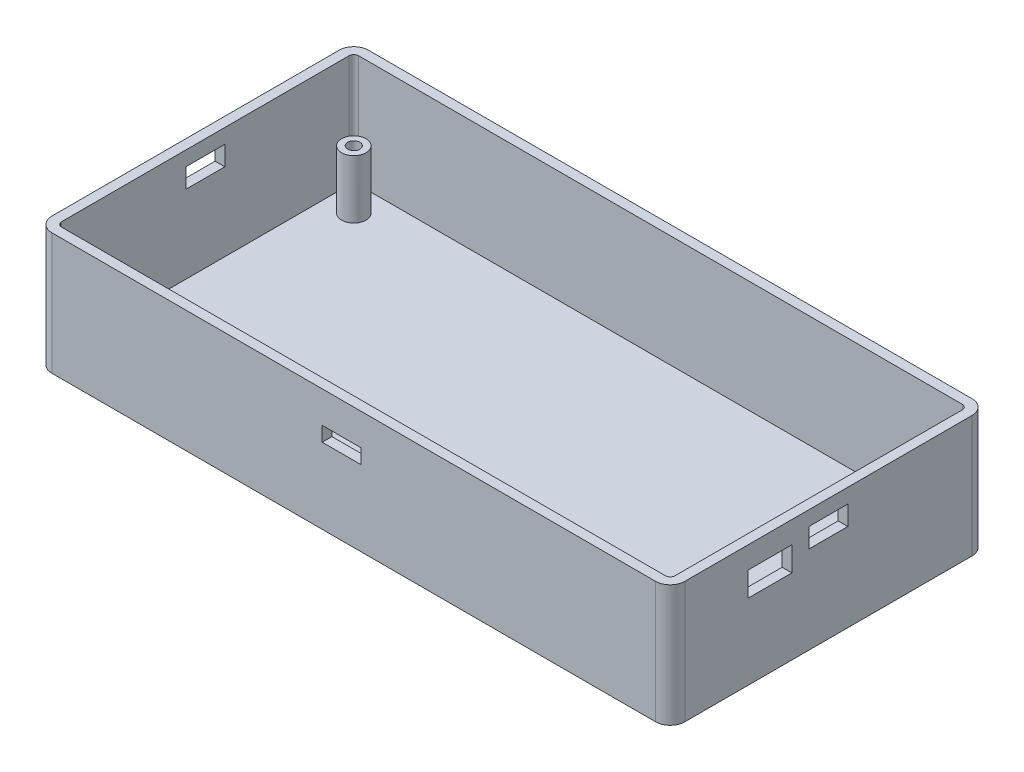
from build123d import *

# Parameters (mm, degrees)
SKETCH_1_W               = 130
SKETCH_1_H               = 65
EXTRUDE_1_DEPTH          = 25
SKETCH_2_W               = 126
SKETCH_2_H               = 61
CUT_EXTRUDE_1_DEPTH      = 23
SKETCH_3_R               = 2.5
EXTRUDE_2_DEPTH          = 12
SKETCH_5_W               = 8
SKETCH_5_H               = 4
CUT_EXTRUDE_3_DEPTH      = 2
SKETCH_6_W               = 8
SKETCH_6_H               = 3
CUT_EXTRUDE_4_DEPTH      = 2
SKETCH_7_W               = 9
SKETCH_7_H               = 5
CUT_EXTRUDE_5_DEPTH      = 2
SKETCH_8_R               = 1.25
CUT_EXTRUDE_6_DEPTH      = 6
MIRROR_7_COPY_1_SKETCH_R = 2.5
MIRROR_7_COPY_1_DEPTH    = 12
MIRROR_7_COPY_2_SKETCH_R = 1.25
MIRROR_7_COPY_2_DEPTH    = 6
FILLET_1_R               = 1
FILLET_2_R               = 3


with BuildPart() as part:
    # Эскиз1 → Бобышка-Вытянуть1 (new body)
    with BuildSketch(Plane(origin=(0, 0, 0), x_dir=(1, 0, 0), z_dir=(0, 1, 0))):
        Rectangle(SKETCH_1_W, SKETCH_1_H)
    extrude(amount=EXTRUDE_1_DEPTH)

    # Эскиз2 → Вырез-Вытянуть1 (cut)
    with BuildSketch(Plane(origin=(0, 25, 0), x_dir=(1, 0, 0), z_dir=(0, 1, 0))):
        Rectangle(SKETCH_2_W, SKETCH_2_H)
    extrude(amount=-CUT_EXTRUDE_1_DEPTH, mode=Mode.SUBTRACT)

    # Эскиз3 → Бобышка-Вытянуть2 (add)
    with BuildSketch(Plane(origin=(0, 2, 0), x_dir=(1, 0, 0), z_dir=(0, 1, 0))):
        with Locations(Location((-57.5, 25, 0), (0, 0, 90))):
            Circle(SKETCH_3_R)
    extrude_2 = extrude(amount=EXTRUDE_2_DEPTH)

    # Эскиз5 → Вырез-Вытянуть3 (cut)
    with BuildSketch(Plane(origin=(65, 0, 0), x_dir=(0, 0, -1), z_dir=(1, 0, 0))):
        with Locations((0, 20)):
            Rectangle(SKETCH_5_W, SKETCH_5_H)
    cut_extrude_3 = extrude(amount=-CUT_EXTRUDE_3_DEPTH, mode=Mode.SUBTRACT)

    # Зеркальное отражение5: Вырез-Вытянуть3 across plane
    add(cut_extrude_3.mirror(Plane(origin=(0, 0, 0), x_dir=(0, 0, 1), z_dir=(1, 0, 0))), mode=Mode.SUBTRACT)

    # Эскиз6 → Вырез-Вытянуть4 (cut)
    with BuildSketch(Plane.XY.offset(32.5)):
        with Locations((-2.5, 17)):
            Rectangle(SKETCH_6_W, SKETCH_6_H)
    extrude(amount=-CUT_EXTRUDE_4_DEPTH, mode=Mode.SUBTRACT)

    # Эскиз7 → Вырез-Вытянуть5 (cut)
    with BuildSketch(Plane(origin=(65, 0, 0), x_dir=(0, 0, -1), z_dir=(1, 0, 0))):
        with Locations((-12, 18)):
            Rectangle(SKETCH_7_W, SKETCH_7_H)
    extrude(amount=-CUT_EXTRUDE_5_DEPTH, mode=Mode.SUBTRACT)

    # Эскиз8 → Вырез-Вытянуть6 (cut)
    with BuildSketch(Plane(origin=(0, 14, 0), x_dir=(1, 0, 0), z_dir=(0, 1, 0))):
        with Locations(Location((-57.5, 25, 0), (0, 0, 270))):
            Circle(SKETCH_8_R)
    cut_extrude_6 = extrude(amount=-CUT_EXTRUDE_6_DEPTH, mode=Mode.SUBTRACT)

    # Зеркальное отражение6: Бобышка-Вытянуть2, Вырез-Вытянуть6 across plane
    add(extrude_2.mirror(Plane(origin=(0, 0, 0), x_dir=(0, 0, 1), z_dir=(1, 0, 0))))
    add(cut_extrude_6.mirror(Plane(origin=(0, 0, 0), x_dir=(0, 0, 1), z_dir=(1, 0, 0))), mode=Mode.SUBTRACT)

    # Зеркальное отражение7: Бобышка-Вытянуть2, Вырез-Вытянуть6 across plane
    add(extrude_2.mirror(Plane.XY))
    add(cut_extrude_6.mirror(Plane.XY), mode=Mode.SUBTRACT)

    # Зеркальное отражение7 copy 1 sketch → Зеркальное отражение7 copy 1 (add)
    with BuildSketch(Plane(origin=(0, 2, 0), x_dir=(-1, 0, 0), z_dir=(0, 1, 0))):
        with Locations(Location((-57.5, 25, 0), (0, 0, 90))):
            Circle(MIRROR_7_COPY_1_SKETCH_R)
    extrude(amount=MIRROR_7_COPY_1_DEPTH)

    # Зеркальное отражение7 copy 2 sketch → Зеркальное отражение7 copy 2 (cut)
    with BuildSketch(Plane(origin=(0, 14, 0), x_dir=(-1, 0, 0), z_dir=(0, 1, 0))):
        with Locations(Location((-57.5, 25, 0), (0, 0, 270))):
            Circle(MIRROR_7_COPY_2_SKETCH_R)
    extrude(amount=-MIRROR_7_COPY_2_DEPTH, mode=Mode.SUBTRACT)

    # Скругление1
    fillet_1_edges = [part.edges().sort_by_distance(p)[0] for p in [
        (63, 13.5, -30.5),
        (63, 13.5, 30.5),
        (-63, 13.5, 30.5),
        (-63, 13.5, -30.5),
    ]]
    fillet(fillet_1_edges, radius=FILLET_1_R)

    # Скругление2
    fillet_2_edges = [part.edges().sort_by_distance(p)[0] for p in [
        (65, 12.5, 32.5),
        (-65, 12.5, 32.5),
        (-65, 12.5, -32.5),
        (65, 12.5, -32.5),
    ]]
    fillet(fillet_2_edges, radius=FILLET_2_R)


solid = part.part
